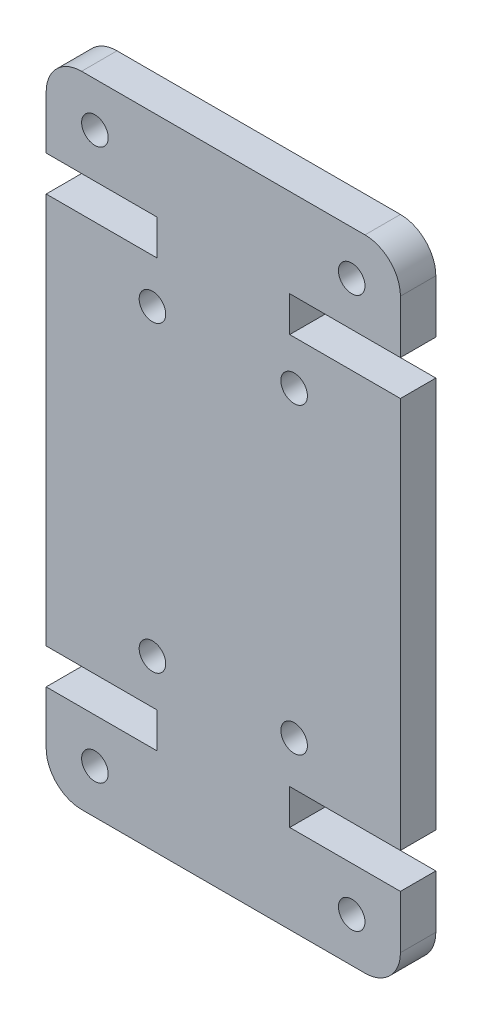
from build123d import *

# Parameters (mm, degrees)
MODEL_R             = 0.75
BOSS_EXTRUDE1_DEPTH = 2


with BuildPart() as part:
    # Model → Boss-Extrude1 (new body)
    with BuildSketch(Plane.XY):
        with BuildLine():
            Line((1967.109841287, 1230.384705077), (1983.109841287, 1230.384705077))
            ThreePointArc((1983.109841287, 1230.384705077), (1984.524054849, 1229.798918639), (1985.109841287, 1228.384705077))
            Line((1985.109841287, 1228.384705077), (1985.109841287, 1225.384705077))
            Line((1985.109841287, 1225.384705077), (1978.859841287, 1225.384705077))
            Line((1978.859841287, 1225.384705077), (1978.859841287, 1223.384705077))
            Line((1978.859841287, 1223.384705077), (1985.109841287, 1223.384705077))
            Line((1985.109841287, 1223.384705077), (1985.109841287, 1201.284705077))
            Line((1985.109841287, 1201.284705077), (1978.859841287, 1201.284705077))
            Line((1978.859841287, 1201.284705077), (1978.859841287, 1199.284705077))
            Line((1978.859841287, 1199.284705077), (1985.109841287, 1199.284705077))
            Line((1985.109841287, 1199.284705077), (1985.109841287, 1196.284705077))
            ThreePointArc((1985.109841287, 1196.284705077), (1984.524054849, 1194.870491514), (1983.109841287, 1194.284705077))
            Line((1983.109841287, 1194.284705077), (1967.109841287, 1194.284705077))
            ThreePointArc((1967.109841287, 1194.284705077), (1965.695627724, 1194.870491514), (1965.109841287, 1196.284705077))
            Line((1965.109841287, 1196.284705077), (1965.109841287, 1199.284705077))
            Line((1965.109841287, 1199.284705077), (1971.359841287, 1199.284705077))
            Line((1971.359841287, 1199.284705077), (1971.359841287, 1201.284705077))
            Line((1971.359841287, 1201.284705077), (1965.109841287, 1201.284705077))
            Line((1965.109841287, 1201.284705077), (1965.109841287, 1223.384705077))
            Line((1965.109841287, 1223.384705077), (1971.359841287, 1223.384705077))
            Line((1971.359841287, 1223.384705077), (1971.359841287, 1225.384705077))
            Line((1971.359841287, 1225.384705077), (1965.109841287, 1225.384705077))
            Line((1965.109841287, 1225.384705077), (1965.109841287, 1228.384705077))
            ThreePointArc((1965.109841287, 1228.384705077), (1965.695627724, 1229.798918639), (1967.109841287, 1230.384705077))
        make_face()
        with Locations((1979.109841287, 1220.884705077)):
            Circle(MODEL_R, mode=Mode.SUBTRACT)
        with Locations((1971.109841287, 1220.884705077)):
            Circle(MODEL_R, mode=Mode.SUBTRACT)
        with Locations((1979.109841287, 1203.784705077)):
            Circle(MODEL_R, mode=Mode.SUBTRACT)
        with Locations((1971.109841287, 1203.784705077)):
            Circle(MODEL_R, mode=Mode.SUBTRACT)
        with Locations((1982.359841287, 1196.784705077)):
            Circle(MODEL_R, mode=Mode.SUBTRACT)
        with Locations((1967.859841287, 1196.784705077)):
            Circle(MODEL_R, mode=Mode.SUBTRACT)
        with Locations((1982.359841287, 1227.884705077)):
            Circle(MODEL_R, mode=Mode.SUBTRACT)
        with Locations((1967.859841287, 1227.884705077)):
            Circle(MODEL_R, mode=Mode.SUBTRACT)
    extrude(amount=BOSS_EXTRUDE1_DEPTH)


solid = part.part
